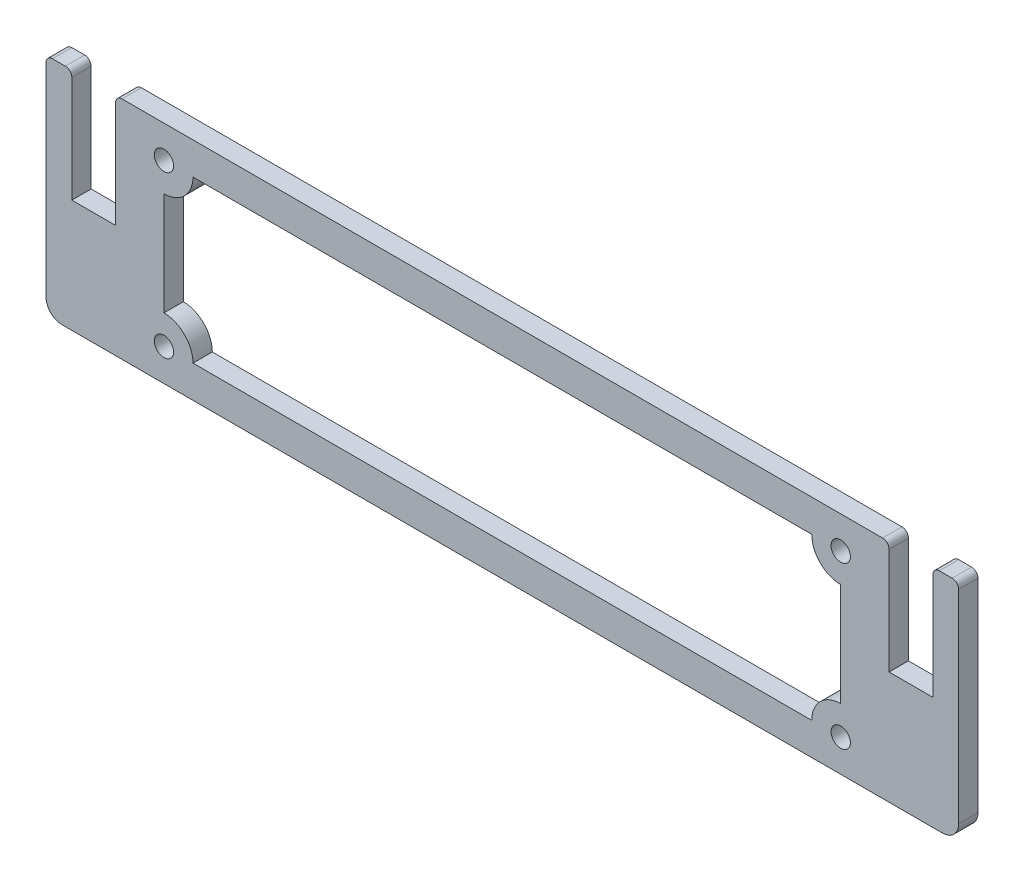
from build123d import *

# Parameters (mm, degrees)
SKETCH_1_R      = 1.5
EXTRUDE_1_DEPTH = 3
FILLET_1_R      = 2.5
FILLET_2_R      = 1


with BuildPart() as part:
    # Эскиз1 → Бобышка-Вытянуть1 (new body)
    with BuildSketch(Plane.XY):
        Polygon((-60, 17.5), (-60, 0), (-66.8, 0), (-66.8, 17.5), (-70.8, 17.5), (-70.8, -17.5), (70.8, -17.5), (70.8, 17.5), (66.8, 17.5), (66.8, 0), (60, 0), (60, 17.5), align=None)
        with BuildLine():
            Line((48, -12.5), (-48, -12.5))
            ThreePointArc((-48, -12.5), (-49.318019485, -9.318019485), (-52.5, -8))
            Line((-52.5, -8), (-52.5, 8))
            ThreePointArc((-52.5, 8), (-49.318019485, 9.318019485), (-48, 12.5))
            Line((-48, 12.5), (48, 12.5))
            ThreePointArc((48, 12.5), (49.318019485, 9.318019485), (52.5, 8))
            Line((52.5, 8), (52.5, -8))
            ThreePointArc((52.5, -8), (49.318019485, -9.318019485), (48, -12.5))
        make_face(mode=Mode.SUBTRACT)
        with Locations((-52.5, 12.5)):
            Circle(SKETCH_1_R, mode=Mode.SUBTRACT)
        with Locations((-52.5, -12.5)):
            Circle(SKETCH_1_R, mode=Mode.SUBTRACT)
        with Locations((52.5, -12.5)):
            Circle(SKETCH_1_R, mode=Mode.SUBTRACT)
        with Locations((52.5, 12.5)):
            Circle(SKETCH_1_R, mode=Mode.SUBTRACT)
    extrude(amount=EXTRUDE_1_DEPTH)

    # Скругление1
    fillet_1_edges = [part.edges().sort_by_distance(p)[0] for p in [
        (-70.8, -17.5, 1.5),
        (70.8, -17.5, 1.5),
    ]]
    fillet(fillet_1_edges, radius=FILLET_1_R)

    # Скругление2
    fillet_2_edges = [part.edges().sort_by_distance(p)[0] for p in [
        (-70.8, 17.5, 1.5),
        (-66.8, 17.5, 1.5),
        (-60, 17.5, 1.5),
        (60, 17.5, 1.5),
        (66.8, 17.5, 1.5),
        (70.8, 17.5, 1.5),
    ]]
    fillet(fillet_2_edges, radius=FILLET_2_R)


solid = part.part
